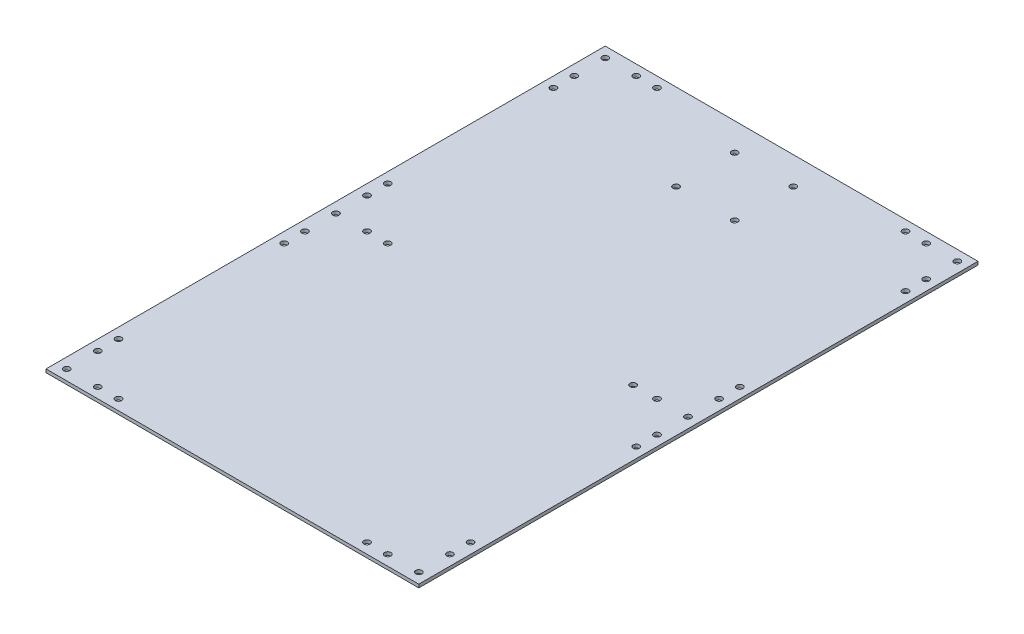
from build123d import *

# Parameters (mm, degrees)
SKETCH1_W             = 360
SKETCH1_H             = 540
BOSS_EXTRUDE1_DEPTH   = 3.175
F_6_0MM_DOWEL_HOLE1_D = 6
F_6_0MM_DOWEL_HOLE2_D = 6


with BuildPart() as part:
    # Sketch1 → Boss-Extrude1 (new body)
    with BuildSketch(Plane(origin=(0, 0, 0), x_dir=(1, 0, 0), z_dir=(0, 1, 0))):
        with Locations((180, -270)):
            Rectangle(SKETCH1_W, SKETCH1_H)
    extrude(amount=BOSS_EXTRUDE1_DEPTH)

    # Ø6.0mm Dowel Hole1 (through all)
    with Locations(Plane(origin=(0, 3.175, 0), x_dir=(1, 0, 0), z_dir=(0, 1, 0))):
        with Locations((151.715728753, -26.715728753), (208.284271247, -26.715728753), (208.284271247, -83.284271247), (151.715728753, -83.284271247)):
            Hole(F_6_0MM_DOWEL_HOLE1_D / 2)

    # Ø6.0mm Dowel Hole2 (through all)
    with Locations(Plane(origin=(0, 3.175, 0), x_dir=(1, 0, 0), z_dir=(0, 1, 0))):
        with Locations((10, -500), (40, -270), (10, -270), (10, -220), (40, -530), (10, -530), (320, -530), (350, -530), (350, -500), (10, -300), (350, -270), (10, -240), (320, -270), (350, -40), (350, -10), (320, -10), (40, -10), (10, -10), (10, -40), (60, -270), (10, -320), (10, -60), (60, -10), (300, -10), (350, -60), (350, -220), (350, -240), (296.924884631, -270), (350, -300), (350, -320), (350, -480), (300, -530), (10, -480), (60, -530)):
            Hole(F_6_0MM_DOWEL_HOLE2_D / 2)


solid = part.part
